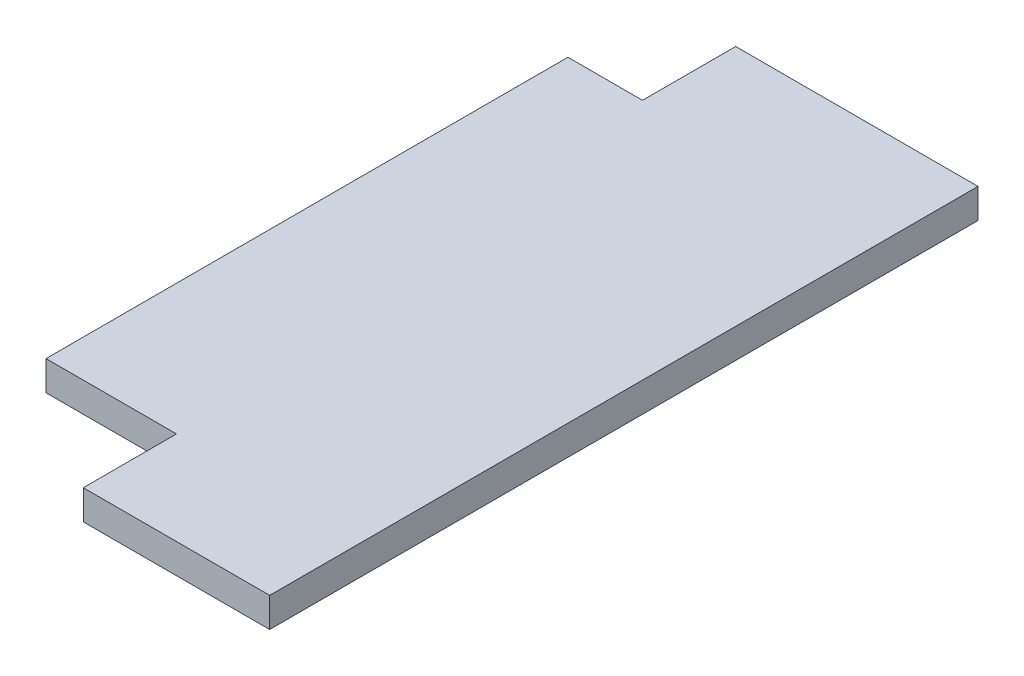
from build123d import *

# Parameters (mm, degrees)
BOSS_EXTRUDE1_DEPTH = 1.5875


with BuildPart() as part:
    # Sketch1 → Boss-Extrude1 (new body)
    with BuildSketch(Plane(origin=(0, 0, 0), x_dir=(1, 0, 0), z_dir=(0, 1, 0))):
        Polygon((0, 0), (0, 38), (-13, 38), (-13, 33), (-17, 33), (-17, 5), (-10, 5), (-10, 0), align=None)
    extrude(amount=BOSS_EXTRUDE1_DEPTH)


solid = part.part
